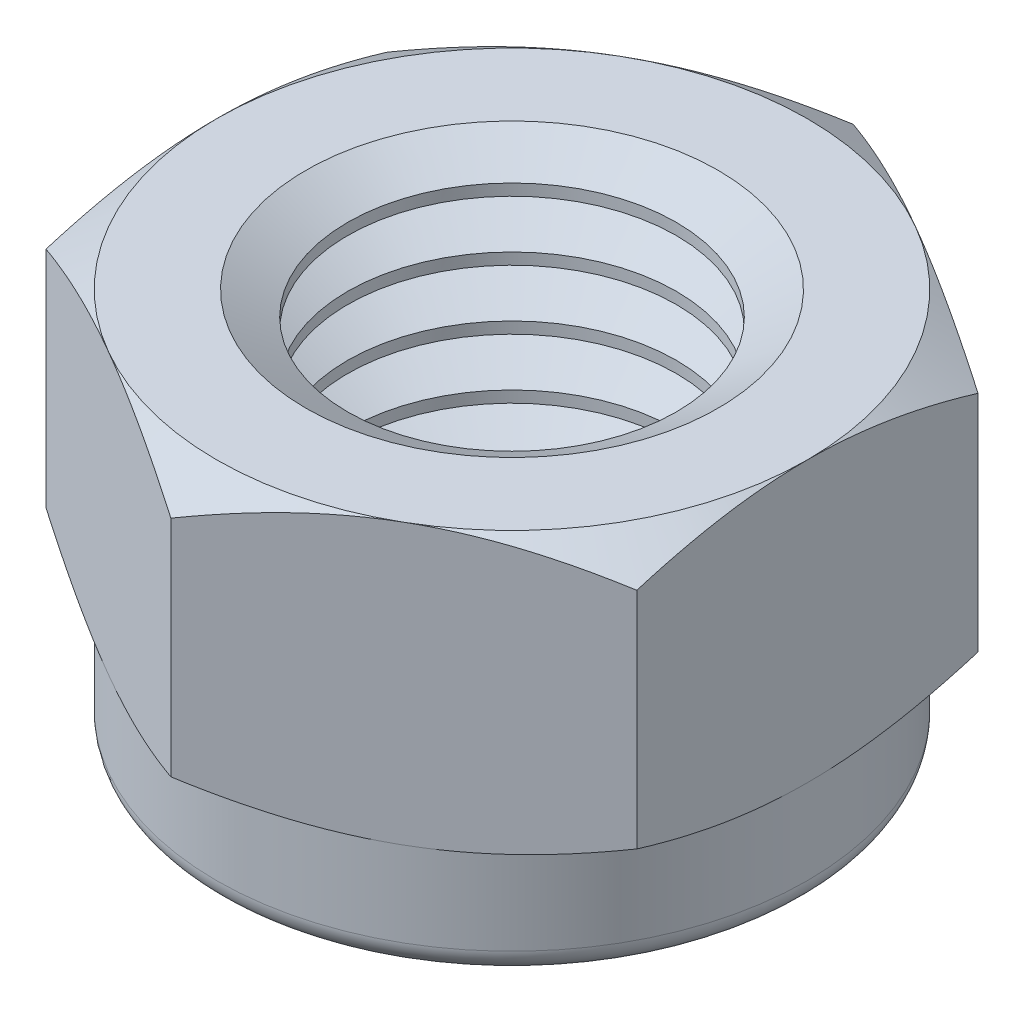
from build123d import *
from build123d.topology import SkipClean

# Parameters (mm, degrees)
SKETCH1_R           = 3.4925
BOSS_EXTRUDE1_DEPTH = 5.9436
BOSS_EXTRUDE2_START = 2.3114
SKETCH2_R           = 6.280156421
SKETCH2_R_2         = 3.4925
BOSS_EXTRUDE2_DEPTH = 2.3114
FILLET2_R           = 0.508
SKETCH4_R           = 4.6355
SKETCH4_R_2         = 3.4925
CUT_EXTRUDE1_DEPTH  = 0.254
SKETCH6_R           = 4.6355
SKETCH6_R_2         = 3.4925
BOSS_EXTRUDE3_DEPTH = 1.778


with BuildPart() as part:
    # Sketch1 → Boss-Extrude1 (new body)
    with BuildSketch(Plane(origin=(0, 0, 0), x_dir=(1, 0, 0), z_dir=(0, 1, 0))):
        Polygon((0, -7.2517), (6.280156421, -3.62585), (6.280156421, 3.62585), (0, 7.2517), (-6.280156421, 3.62585), (-6.280156421, -3.62585), align=None)
        with Locations(Location((0, 0, 0), (0, 0, 270))):
            Circle(SKETCH1_R, mode=Mode.SUBTRACT)
    extrude(amount=BOSS_EXTRUDE1_DEPTH)

    # Sketch2 → Boss-Extrude2 (add)
    with SkipClean():  # the faces are left unmerged after this step: merging them gives an invalid solid
        with BuildSketch(Plane.XZ.offset(BOSS_EXTRUDE2_START)):
            with Locations(Location((0, 0, 0), (0, 0, 120))):
                Circle(SKETCH2_R)
            with Locations(Location((0, 0, 0), (0, 0, 270))):
                Circle(SKETCH2_R_2, mode=Mode.SUBTRACT)
        extrude(amount=-BOSS_EXTRUDE2_DEPTH)

    # Fillet2
    fillet2_edges = [part.edges().sort_by_distance(p)[0] for p in [
        (3.14007821, -2.3114, -5.438775),
    ]]
    fillet(fillet2_edges, radius=FILLET2_R)

    # Sketch3 → Cut-Revolve1 (revolve, cut)
    with BuildSketch(Plane(origin=(0, 0, 0), x_dir=(0, 0, -1), z_dir=(1, 0, 0)), mode=Mode.PRIVATE) as cut_revolve1_sk:
        Polygon((-7.2517, 0.593112632), (-7.2517, 0), (-6.280156421, 0), align=None)
        Polygon((-6.280156421, 5.9436), (-7.2517, 5.9436), (-7.2517, 5.355420001), align=None)
        Polygon((-3.391632963, 6.5151), (-4.3815, 5.9436), (-3.294472118, 5.31600416), align=None)
        Polygon((-3.391632963, 5.2451), (-4.3815, 4.6736), (-3.294472118, 4.04600416), align=None)
        Polygon((-3.391632963, 3.9751), (-4.3815, 3.4036), (-3.294472118, 2.77600416), align=None)
        Polygon((-3.391632963, 2.7051), (-4.3815, 2.1336), (-3.294472118, 1.50600416), align=None)
        Polygon((-3.391632963, 1.4351), (-4.3815, 0.8636), (-3.294472118, 0.23600416), align=None)
        Polygon((-3.391632963, 0.1651), (-4.3815, -0.4064), (-3.294472118, -1.03399584), align=None)
        Polygon((-3.391632963, -1.1049), (-4.3815, -1.6764), (-3.294472118, -2.30399584), align=None)
    revolve(cut_revolve1_sk.sketch.rotate(Axis((0, 0, 0), (0, 1, 0)), 180), axis=Axis((0, 0, 0), (0, 1, 0)), mode=Mode.SUBTRACT)

    # Sketch4 → Cut-Extrude1 (cut)
    with BuildSketch(Plane.XZ.offset(2.3114)):
        with Locations(Location((0, 0, 0), (0, 0, 270))):
            Circle(SKETCH4_R)
        with Locations(Location((0, 0, 0), (0, 0, 270))):
            Circle(SKETCH4_R_2, mode=Mode.SUBTRACT)
    extrude(amount=-CUT_EXTRUDE1_DEPTH, mode=Mode.SUBTRACT)

    # Sketch6 → Boss-Extrude3 (add)
    with BuildSketch(Plane.XZ.offset(2.0574)):
        with Locations(Location((0, 0, 0), (0, 0, 270))):
            Circle(SKETCH6_R)
        with Locations(Location((0, 0, 0), (0, 0, 270))):
            Circle(SKETCH6_R_2, mode=Mode.SUBTRACT)
    extrude(amount=-BOSS_EXTRUDE3_DEPTH)


solid = part.part
